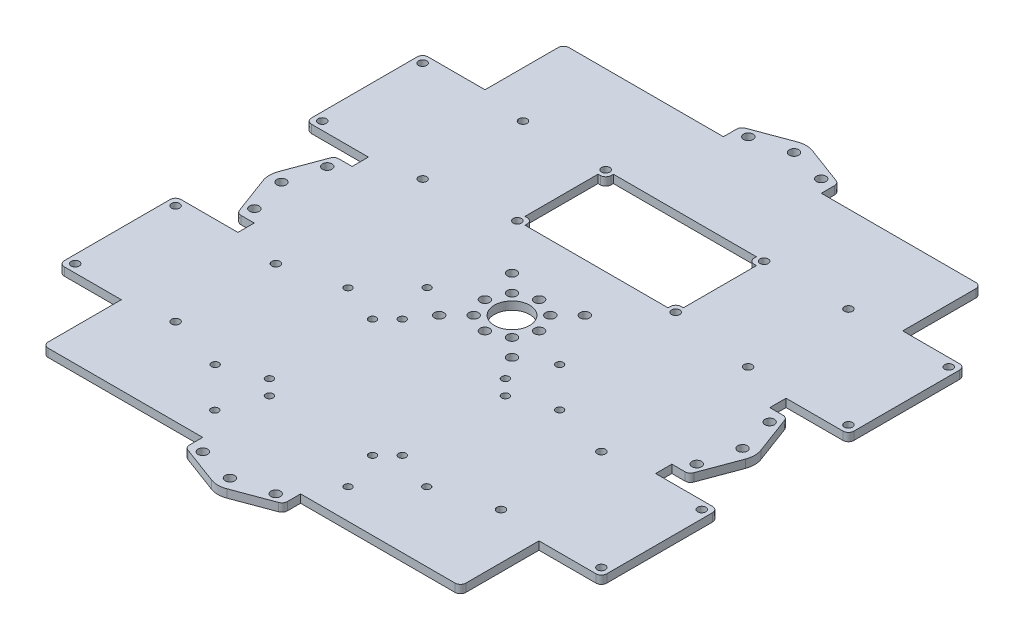
from build123d import *

# Parameters (mm, degrees)
ESQUISSE1_R        = 6.5
ESQUISSE1_R_2      = 1.75
ESQUISSE1_R_3      = 1.749999999
ESQUISSE1_R_4      = 1.5
ESQUISSE1_R_5      = 1.35
BOSS_EXTRU_1_DEPTH = 3
CONG_2_R           = 2
CONG_3_R           = 2
CONG_4_R           = 2
CONG_5_R           = 8


with BuildPart() as part:
    # Esquisse1 → Boss.-Extru.1 (new body)
    with BuildSketch(Plane(origin=(0, 0, 0), x_dir=(1, 0, 0), z_dir=(0, 1, 0))):
        Polygon((-2.91456503, -84.414958458), (-2.91456503, -78.132472986), (56.03543497, -78.132472986), (56.03543497, -49.182472986), (79.03543497, -49.182472986), (79.03543497, -6.182472986), (56.03543497, -6.182472986), (56.03543497, -0.182472986), (62.317920548, -0.182472986), (64.03543497, 4.432498172), (69.03543497, 17.867527014), (64.03543497, 31.302555857), (62.317920548, 35.917527014), (56.03543497, 35.917527014), (56.03543497, 41.917527014), (79.03543497, 41.917527014), (79.03543497, 84.917527015), (56.03543497, 84.917527015), (56.03543497, 113.867527015), (-2.91456503, 113.867527015), (-2.91456503, 120.150012487), (-7.5295364, 121.867527015), (-20.96456503, 126.867527015), (-34.399593661, 121.867527015), (-39.01456503, 120.150012487), (-39.01456503, 113.867527015), (-97.96456503, 113.867527015), (-97.96456503, 84.917527015), (-120.96456503, 84.917527015), (-120.96456503, 41.917527014), (-97.96456503, 41.917527014), (-97.96456503, 35.917527015), (-104.247050609, 35.917527015), (-105.96456503, 31.302555857), (-110.96456503, 17.867527015), (-105.96456503, 4.432498172), (-104.247050609, -0.182472986), (-97.96456503, -0.182472986), (-97.96456503, -6.182472986), (-120.96456503, -6.182472986), (-120.96456503, -49.182472986), (-97.96456503, -49.182472986), (-97.96456503, -78.132472986), (-39.01456503, -78.132472986), (-39.01456503, -84.414958458), (-34.399593661, -86.132472986), (-20.96456503, -91.132472986), (-7.5295364, -86.132472986), align=None)
        with Locations(Location((-20.96456503, 17.867527014, 0), (0, 0, 270))):
            Circle(ESQUISSE1_R, mode=Mode.SUBTRACT)
        with Locations(Location((-20.96456503, 27.867527014, 0), (0, 0, 270))):
            Circle(ESQUISSE1_R_2, mode=Mode.SUBTRACT)
        with Locations(Location((-13.893497007, 24.938594615, 0), (0, 0, 270))):
            Circle(ESQUISSE1_R_2, mode=Mode.SUBTRACT)
        with Locations(Location((-10.96456503, 17.867527014, 0), (0, 0, 270))):
            Circle(ESQUISSE1_R_2, mode=Mode.SUBTRACT)
        with Locations(Location((-13.893497218, 10.796459203, 0), (0, 0, 270))):
            Circle(ESQUISSE1_R_2, mode=Mode.SUBTRACT)
        with Locations(Location((-20.96456503, 7.867527014, 0), (0, 0, 270))):
            Circle(ESQUISSE1_R_2, mode=Mode.SUBTRACT)
        with Locations(Location((-28.035632842, 10.796459203, 0), (0, 0, 270))):
            Circle(ESQUISSE1_R_2, mode=Mode.SUBTRACT)
        with Locations(Location((-30.96456503, 17.867527014, 0), (0, 0, 270))):
            Circle(ESQUISSE1_R_2, mode=Mode.SUBTRACT)
        with Locations(Location((-28.03563265, 24.938595058, 0), (0, 0, 270))):
            Circle(ESQUISSE1_R_3, mode=Mode.SUBTRACT)
        with Locations(Location((-7.529535976, 31.302555645, 0), (0, 0, 270))):
            Circle(ESQUISSE1_R_2, mode=Mode.SUBTRACT)
        with Locations(Location((-7.529536188, 4.432498172, 0), (0, 0, 270))):
            Circle(ESQUISSE1_R_2, mode=Mode.SUBTRACT)
        with Locations(Location((-34.399593661, 31.302556069, 0), (0, 0, 270))):
            Circle(ESQUISSE1_R_2, mode=Mode.SUBTRACT)
        with Locations(Location((-34.399593873, 4.432498172, 0), (0, 0, 270))):
            Circle(ESQUISSE1_R_2, mode=Mode.SUBTRACT)
        with Locations(Location((64.03543497, 17.867527014, 0), (0, 0, 270))):
            Circle(ESQUISSE1_R_2, mode=Mode.SUBTRACT)
        with Locations(Location((60.600406339, 31.302556069, 0), (0, 0, 270))):
            Circle(ESQUISSE1_R_2, mode=Mode.SUBTRACT)
        with Locations(Location((60.600406127, 4.432498172, 0), (0, 0, 270))):
            Circle(ESQUISSE1_R_2, mode=Mode.SUBTRACT)
        with Locations(Location((-102.529536188, 4.432498172, 0), (0, 0, 270))):
            Circle(ESQUISSE1_R_2, mode=Mode.SUBTRACT)
        with Locations(Location((-105.96456503, 17.867527014, 0), (0, 0, 270))):
            Circle(ESQUISSE1_R_2, mode=Mode.SUBTRACT)
        with Locations(Location((-102.5295364, 31.302555857, 0), (0, 0, 270))):
            Circle(ESQUISSE1_R_2, mode=Mode.SUBTRACT)
        with Locations(Location((-20.96456503, -86.132472986, 0), (0, 0, 270))):
            Circle(ESQUISSE1_R_2, mode=Mode.SUBTRACT)
        with Locations(Location((-7.529535976, -82.697444355, 0), (0, 0, 270))):
            Circle(ESQUISSE1_R_2, mode=Mode.SUBTRACT)
        with Locations(Location((-34.399593661, -82.697443931, 0), (0, 0, 270))):
            Circle(ESQUISSE1_R_2, mode=Mode.SUBTRACT)
        with Locations(Location((-34.399593661, 118.43249796, 0), (0, 0, 270))):
            Circle(ESQUISSE1_R_2, mode=Mode.SUBTRACT)
        with Locations(Location((-20.96456503, 121.867527014, 0), (0, 0, 270))):
            Circle(ESQUISSE1_R_2, mode=Mode.SUBTRACT)
        with Locations(Location((-7.5295364, 118.432498384, 0), (0, 0, 270))):
            Circle(ESQUISSE1_R_2, mode=Mode.SUBTRACT)
        with Locations(Location((-117.96456503, -46.182472986, 0), (0, 0, 270))):
            Circle(ESQUISSE1_R_4, mode=Mode.SUBTRACT)
        with Locations(Location((-117.96456503, -9.182472986, 0), (0, 0, 270))):
            Circle(ESQUISSE1_R_4, mode=Mode.SUBTRACT)
        with Locations(Location((-80.96456503, -9.182472986, 0), (0, 0, 270))):
            Circle(ESQUISSE1_R_4, mode=Mode.SUBTRACT)
        with Locations(Location((-80.96456503, -46.182472986, 0), (0, 0, 270))):
            Circle(ESQUISSE1_R_4, mode=Mode.SUBTRACT)
        with Locations(Location((-80.96456503, 81.917527014, 0), (0, 0, 270))):
            Circle(ESQUISSE1_R_4, mode=Mode.SUBTRACT)
        with Locations(Location((-80.96456503, 44.917527014, 0), (0, 0, 270))):
            Circle(ESQUISSE1_R_4, mode=Mode.SUBTRACT)
        with Locations(Location((-117.96456503, 44.917527014, 0), (0, 0, 270))):
            Circle(ESQUISSE1_R_4, mode=Mode.SUBTRACT)
        with Locations(Location((-117.96456503, 81.917527014, 0), (0, 0, 270))):
            Circle(ESQUISSE1_R_4, mode=Mode.SUBTRACT)
        with Locations(Location((39.03543497, -46.182472986, 0), (0, 0, 270))):
            Circle(ESQUISSE1_R_4, mode=Mode.SUBTRACT)
        with Locations(Location((39.03543497, -9.182472986, 0), (0, 0, 270))):
            Circle(ESQUISSE1_R_4, mode=Mode.SUBTRACT)
        with Locations(Location((76.03543497, -9.182472986, 0), (0, 0, 270))):
            Circle(ESQUISSE1_R_4, mode=Mode.SUBTRACT)
        with Locations(Location((76.03543497, -46.182472986, 0), (0, 0, 270))):
            Circle(ESQUISSE1_R_4, mode=Mode.SUBTRACT)
        with Locations(Location((76.03543497, 81.917527014, 0), (0, 0, 270))):
            Circle(ESQUISSE1_R_4, mode=Mode.SUBTRACT)
        with Locations(Location((76.03543497, 44.917527014, 0), (0, 0, 270))):
            Circle(ESQUISSE1_R_4, mode=Mode.SUBTRACT)
        with Locations(Location((39.03543497, 44.917527014, 0), (0, 0, 270))):
            Circle(ESQUISSE1_R_4, mode=Mode.SUBTRACT)
        with Locations(Location((39.03543497, 81.917527014, 0), (0, 0, 270))):
            Circle(ESQUISSE1_R_4, mode=Mode.SUBTRACT)
        with Locations(Location((-50.16456503, 81.617527014, 0), (0, 0, 270))):
            Circle(ESQUISSE1_R_4, mode=Mode.SUBTRACT)
        with Locations(Location((8.23543497, 81.617527014, 0), (0, 0, 270))):
            Circle(ESQUISSE1_R_4, mode=Mode.SUBTRACT)
        with Locations(Location((-50.16456503, 49.025963561, 0), (0, 0, 270))):
            Circle(ESQUISSE1_R_4, mode=Mode.SUBTRACT)
        with Locations(Location((8.23543497, 49.025963561, 0), (0, 0, 270))):
            Circle(ESQUISSE1_R_4, mode=Mode.SUBTRACT)
        with Locations(Location((3.53543497, 10.917526446, 0), (0, 0, 270))):
            Circle(ESQUISSE1_R_5, mode=Mode.SUBTRACT)
        with Locations(Location((-45.46456503, 11.063618868, 0), (0, 0, 270))):
            Circle(ESQUISSE1_R_5, mode=Mode.SUBTRACT)
        with Locations(Location((-45.46456503, -47.082473554, 0), (0, 0, 270))):
            Circle(ESQUISSE1_R_5, mode=Mode.SUBTRACT)
        with Locations(Location((3.53543497, -47.082473554, 0), (0, 0, 270))):
            Circle(ESQUISSE1_R_5, mode=Mode.SUBTRACT)
        with Locations(Location((-59.96456503, -3.582473554, 0), (0, 0, 270))):
            Circle(ESQUISSE1_R_5, mode=Mode.SUBTRACT)
        with Locations(Location((-59.96456503, -52.582473554, 0), (0, 0, 270))):
            Circle(ESQUISSE1_R_5, mode=Mode.SUBTRACT)
        with Locations(Location((-1.96456503, -3.582473554, 0), (0, 0, 270))):
            Circle(ESQUISSE1_R_5, mode=Mode.SUBTRACT)
        with Locations(Location((-1.96456503, -52.582473554, 0), (0, 0, 270))):
            Circle(ESQUISSE1_R_5, mode=Mode.SUBTRACT)
        with Locations(Location((-39.96456503, -3.582473554, 0), (0, 0, 270))):
            Circle(ESQUISSE1_R_5, mode=Mode.SUBTRACT)
        with Locations(Location((-39.96456503, -52.582473554, 0), (0, 0, 270))):
            Circle(ESQUISSE1_R_5, mode=Mode.SUBTRACT)
        with Locations(Location((18.03543497, -52.582473554, 0), (0, 0, 270))):
            Circle(ESQUISSE1_R_5, mode=Mode.SUBTRACT)
        with Locations(Location((18.03543497, -3.582473554, 0), (0, 0, 270))):
            Circle(ESQUISSE1_R_5, mode=Mode.SUBTRACT)
        with Locations(Location((-45.46456503, -67.228565977, 0), (0, 0, 270))):
            Circle(ESQUISSE1_R_5, mode=Mode.SUBTRACT)
        with Locations(Location((3.53543497, -67.082473554, 0), (0, 0, 270))):
            Circle(ESQUISSE1_R_5, mode=Mode.SUBTRACT)
        with Locations(Location((3.53543497, -9.082473554, 0), (0, 0, 270))):
            Circle(ESQUISSE1_R_5, mode=Mode.SUBTRACT)
        with Locations(Location((-45.46456503, -9.082473554, 0), (0, 0, 270))):
            Circle(ESQUISSE1_R_5, mode=Mode.SUBTRACT)
        Polygon((-50.16456503, 78.78909989), (-47.336137906, 78.78909989), (-47.336137906, 81.617527014), (5.407007845, 81.617527014), (5.407007845, 78.78909989), (8.23543497, 78.78909989), (8.23543497, 51.854390686), (5.407007845, 51.854390686), (5.407007845, 49.025963561), (-47.336137906, 49.025963561), (-47.336137906, 51.854390686), (-50.16456503, 51.854390686), align=None, mode=Mode.SUBTRACT)
    extrude(amount=BOSS_EXTRU_1_DEPTH)

    # Congé2
    cong_2_edges = [part.edges().sort_by_distance(p)[0] for p in [
        (-97.96456503, 1.5, -113.867527015),
        (56.03543497, 1.5, -113.867527015),
        (79.03543497, 1.5, -84.917527015),
        (79.03543497, 1.5, -41.917527014),
        (79.03543497, 1.5, 6.182472986),
        (79.03543497, 1.5, 49.182472986),
        (56.03543497, 1.5, 78.132472986),
        (-97.96456503, 1.5, 78.132472986),
        (-120.96456503, 1.5, 49.182472986),
        (-120.96456503, 1.5, 6.182472986),
        (-120.96456503, 1.5, -41.917527014),
        (-120.96456503, 1.5, -84.917527015),
    ]]
    fillet(cong_2_edges, radius=CONG_2_R)

    # Congé3
    cong_3_edges = [part.edges().sort_by_distance(p)[0] for p in [
        (-47.336137906, 1.5, -51.854390686),
        (5.407007845, 1.5, -51.854390686),
        (5.407007845, 1.5, -78.78909989),
        (-47.336137906, 1.5, -78.78909989),
    ]]
    fillet(cong_3_edges, radius=CONG_3_R)

    # Congé4
    cong_4_edges = [part.edges().sort_by_distance(p)[0] for p in [
        (-39.01456503, 1.5, -120.150012487),
        (-2.91456503, 1.5, -120.150012487),
        (62.317920548, 1.5, -35.917527014),
        (62.317920548, 1.5, 0.182472986),
        (-2.91456503, 1.5, 84.414958458),
        (-39.01456503, 1.5, 84.414958458),
        (-104.247050609, 1.5, 0.182472986),
        (-104.247050609, 1.5, -35.917527015),
    ]]
    fillet(cong_4_edges, radius=CONG_4_R)

    # Congé5
    cong_5_edges = [part.edges().sort_by_distance(p)[0] for p in [
        (-20.96456503, 1.5, -126.867527015),
        (69.03543497, 1.5, -17.867527014),
        (-20.96456503, 1.5, 91.132472986),
        (-110.96456503, 1.5, -17.867527015),
    ]]
    fillet(cong_5_edges, radius=CONG_5_R)


solid = part.part
